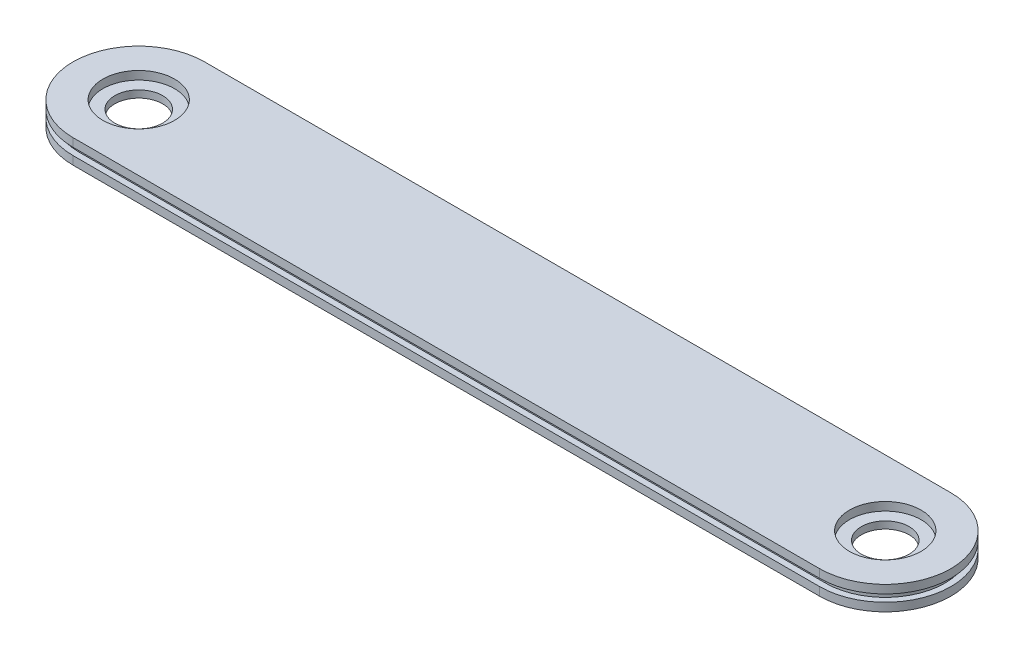
from build123d import *

# Parameters (mm, degrees)
BOSS_EXTRUDE1_DEPTH = 10
SKETCH1_3_OUTSIDE_W = 885.69
SKETCH1_3_OUTSIDE_H = 260.69
SKETCH1_3_OUTSIDE_R = 30
CUT_EXTRUDE1_DEPTH  = 3
SKETCH1_5_R         = 30
CUT_EXTRUDE3_DEPTH  = 10
SKETCH1_6_R         = 30
SKETCH1_6_R_2       = 20
BOSS_EXTRUDE2_DEPTH = 3
SKETCH1_7_R         = 30
CUT_EXTRUDE4_DEPTH  = 10
SKETCH1_8_R         = 30
SKETCH1_8_R_2       = 20
BOSS_EXTRUDE3_DEPTH = 3


with BuildPart() as part:
    # Sketch1 → Boss-Extrude1 (new, symmetric)
    with BuildSketch(Plane(origin=(0, 0, 0), x_dir=(1, 0, 0), z_dir=(0, 1, 0))):
        with BuildLine():
            Line((0, 55), (625, 55))
            ThreePointArc((625, 55), (680, 0), (625, -55))
            Line((625, -55), (0, -55))
            ThreePointArc((0, -55), (-55, 0), (0, 55))
        make_face()
    extrude(amount=BOSS_EXTRUDE1_DEPTH, both=True)

    # Sketch1<3> outside → Cut-Extrude1 (cut, symmetric)
    # profile 1 of 3: a face of its own
    with BuildSketch(Plane(origin=(0, 0, 0), x_dir=(1, 0, 0), z_dir=(0, 1, 0))):
        with Locations((312.5, 0)):
            Rectangle(SKETCH1_3_OUTSIDE_W, SKETCH1_3_OUTSIDE_H)
        with BuildLine():
            Line((0, 50), (625, 50))
            ThreePointArc((625, 50), (675, 0), (625, -50))
            Line((625, -50), (0, -50))
            ThreePointArc((0, -50), (-50, 0), (0, 50))
        make_face(mode=Mode.SUBTRACT)
    # profile 2 of 3: a face of its own
    with BuildSketch(Plane(origin=(0, 0, 0), x_dir=(1, 0, 0), z_dir=(0, 1, 0))):
        with Locations(Location((0, 0, 0), (0, 0, 270))):
            Circle(SKETCH1_3_OUTSIDE_R)
    # profile 3 of 3: a face of its own
    with BuildSketch(Plane(origin=(0, 0, 0), x_dir=(1, 0, 0), z_dir=(0, 1, 0))):
        with Locations(Location((625, 0, 0), (0, 0, 270))):
            Circle(SKETCH1_3_OUTSIDE_R)
    extrude(amount=CUT_EXTRUDE1_DEPTH, both=True, mode=Mode.SUBTRACT)

    # Sketch1<5> → Cut-Extrude3 (cut, symmetric)
    with BuildSketch(Plane(origin=(0, 0, 0), x_dir=(1, 0, 0), z_dir=(0, 1, 0))):
        with Locations(Location((625, 0, 0), (0, 0, 270))):
            Circle(SKETCH1_5_R)
    extrude(amount=CUT_EXTRUDE3_DEPTH, both=True, mode=Mode.SUBTRACT)

    # Sketch1<6> → Boss-Extrude2 (add, symmetric)
    with BuildSketch(Plane(origin=(0, 0, 0), x_dir=(1, 0, 0), z_dir=(0, 1, 0))):
        with Locations(Location((625, 0, 0), (0, 0, 270))):
            Circle(SKETCH1_6_R)
        with Locations(Location((625, 0, 0), (0, 0, 270))):
            Circle(SKETCH1_6_R_2, mode=Mode.SUBTRACT)
    extrude(amount=BOSS_EXTRUDE2_DEPTH, both=True)

    # Sketch1<7> → Cut-Extrude4 (cut, symmetric)
    with BuildSketch(Plane(origin=(0, 0, 0), x_dir=(1, 0, 0), z_dir=(0, 1, 0))):
        with Locations(Location((0, 0, 0), (0, 0, 270))):
            Circle(SKETCH1_7_R)
    extrude(amount=CUT_EXTRUDE4_DEPTH, both=True, mode=Mode.SUBTRACT)

    # Sketch1<8> → Boss-Extrude3 (add, symmetric)
    with BuildSketch(Plane(origin=(0, 0, 0), x_dir=(1, 0, 0), z_dir=(0, 1, 0))):
        with Locations(Location((0, 0, 0), (0, 0, 270))):
            Circle(SKETCH1_8_R)
        with Locations(Location((0, 0, 0), (0, 0, 270))):
            Circle(SKETCH1_8_R_2, mode=Mode.SUBTRACT)
    extrude(amount=BOSS_EXTRUDE3_DEPTH, both=True)


solid = part.part
